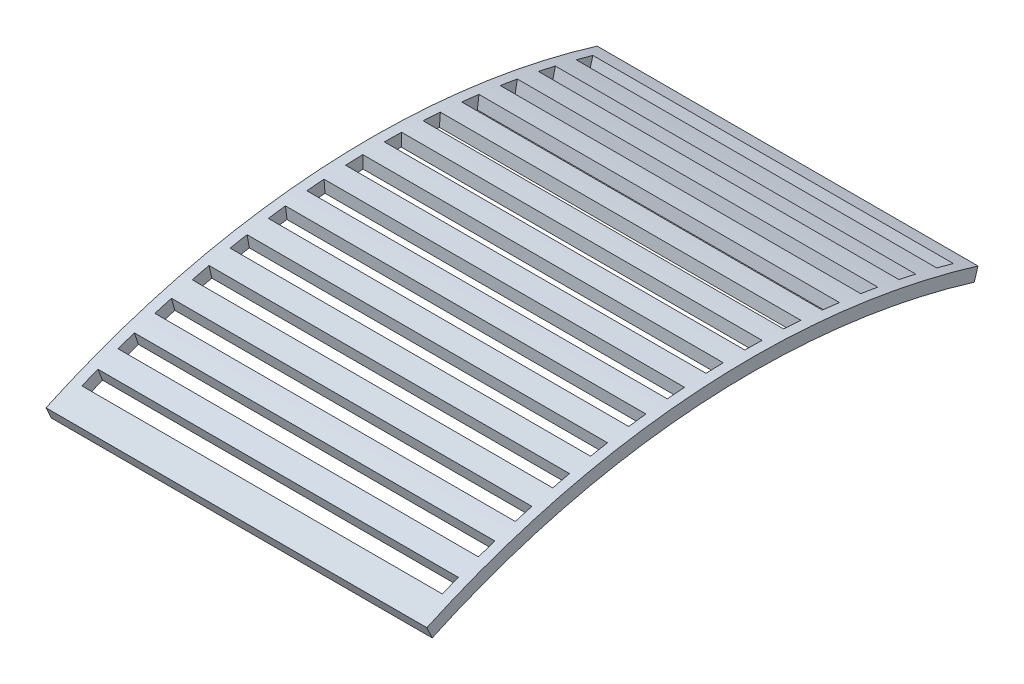
from build123d import *

# Parameters (mm, degrees)
SKETCH2_R                 = 180
SKETCH2_R_2               = 178
EXTRUDE_THIN1_DEPTH       = 90
WRAP1_SECTION_W           = 3
WRAP1_SECTION_H           = 2.3866999
WRAP1_ANGLE               = 41.69859509
WRAP1_SECTOR_2_SECTION_W  = 3
WRAP1_SECTOR_2_SECTION_H  = 85
WRAP1_SECTOR_2_ANGLE      = 2.067873213
WRAP1_SECTOR_3_SECTION_W  = 3
WRAP1_SECTOR_3_SECTION_H  = 85
WRAP1_SECTOR_3_ANGLE      = 1.591549431
WRAP1_SECTOR_4_SECTION_W  = 3
WRAP1_SECTOR_4_SECTION_H  = 85
WRAP1_SECTOR_4_ANGLE      = 1.591549431
WRAP1_SECTOR_5_SECTION_W  = 3
WRAP1_SECTOR_5_SECTION_H  = 85
WRAP1_SECTOR_5_ANGLE      = 1.591549431
WRAP1_SECTOR_6_SECTION_W  = 3
WRAP1_SECTOR_6_SECTION_H  = 85
WRAP1_SECTOR_6_ANGLE      = 1.591549431
WRAP1_SECTOR_7_SECTION_W  = 3
WRAP1_SECTOR_7_SECTION_H  = 85
WRAP1_SECTOR_7_ANGLE      = 1.591549431
WRAP1_SECTOR_8_SECTION_W  = 3
WRAP1_SECTOR_8_SECTION_H  = 85
WRAP1_SECTOR_8_ANGLE      = 1.591549431
WRAP1_SECTOR_9_SECTION_W  = 3
WRAP1_SECTOR_9_SECTION_H  = 85
WRAP1_SECTOR_9_ANGLE      = 1.591549431
WRAP1_SECTOR_10_SECTION_W = 3
WRAP1_SECTOR_10_SECTION_H = 85
WRAP1_SECTOR_10_ANGLE     = 1.591549431
WRAP1_SECTOR_11_SECTION_W = 3
WRAP1_SECTOR_11_SECTION_H = 85
WRAP1_SECTOR_11_ANGLE     = 1.591549431
WRAP1_SECTOR_12_SECTION_W = 3
WRAP1_SECTOR_12_SECTION_H = 85
WRAP1_SECTOR_12_ANGLE     = 1.591549431
WRAP1_SECTOR_13_SECTION_W = 3
WRAP1_SECTOR_13_SECTION_H = 85
WRAP1_SECTOR_13_ANGLE     = 1.591549431
WRAP1_SECTOR_14_SECTION_W = 3
WRAP1_SECTOR_14_SECTION_H = 85
WRAP1_SECTOR_14_ANGLE     = 1.591549431
WRAP1_SECTOR_15_SECTION_W = 3
WRAP1_SECTOR_15_SECTION_H = 85
WRAP1_SECTOR_15_ANGLE     = 1.591549431
WRAP1_SECTOR_16_SECTION_W = 3
WRAP1_SECTOR_16_SECTION_H = 85
WRAP1_SECTOR_16_ANGLE     = 1.115225649
WRAP1_SECTOR_17_SECTION_W = 3
WRAP1_SECTOR_17_SECTION_H = 2.4233001
WRAP1_SECTOR_17_ANGLE     = 41.69859509
SKETCH5_R                 = 180
CUT_EXTRUDE1_DEPTH        = 119


with BuildPart() as part:
    # Sketch2 → Extrude-Thin1 (new body)
    with BuildSketch(Plane(origin=(0, 0, 0), x_dir=(0, 0, -1), z_dir=(1, 0, 0))):
        with Locations((0, -8.237834894)):
            Circle(SKETCH2_R)
        with Locations((0, -8.237834894)):
            Circle(SKETCH2_R_2, mode=Mode.SUBTRACT)
    extrude(amount=EXTRUDE_THIN1_DEPTH)

    # Wrap1 section (on wrap section) → Wrap1 (revolve)
    with BuildSketch(Plane(origin=(0, -8.237834894, 0), x_dir=(0, 0.9080540786996547, 0.41885294574220344), z_dir=(0, -0.41885294574220344, 0.9080540786996547))):
        with Locations((181.5, -88.70726195)):
            Rectangle(WRAP1_SECTION_W, WRAP1_SECTION_H)
    revolve(axis=Axis((0, -8.237834894, 0), (-1, 0, 0)), revolution_arc=WRAP1_ANGLE)

    # Wrap1 sector 2 section (on wrap section) → Wrap1 sector 2 (revolve)
    with BuildSketch(Plane(origin=(0, -8.237834894, 0), x_dir=(0, 0.9080540786996547, 0.41885294574220344), z_dir=(0, -0.41885294574220344, 0.9080540786996547))):
        with Locations((181.5, -45.013912)):
            Rectangle(WRAP1_SECTOR_2_SECTION_W, WRAP1_SECTOR_2_SECTION_H)
    revolve(axis=Axis((0, -8.237834894, 0), (-1, 0, 0)), revolution_arc=WRAP1_SECTOR_2_ANGLE)

    # Wrap1 sector 3 section (on wrap section) → Wrap1 sector 3 (revolve)
    with BuildSketch(Plane(origin=(0, -8.237834894, 0), x_dir=(0, 0.9309215245835882, 0.3652192698461676), z_dir=(0, -0.3652192698461676, 0.9309215245835882))):
        with Locations((181.5, -45.013912)):
            Rectangle(WRAP1_SECTOR_3_SECTION_W, WRAP1_SECTOR_3_SECTION_H)
    revolve(axis=Axis((0, -8.237834894, 0), (-1, 0, 0)), revolution_arc=WRAP1_SECTOR_3_ANGLE)

    # Wrap1 sector 4 section (on wrap section) → Wrap1 sector 4 (revolve)
    with BuildSketch(Plane(origin=(0, -8.237834894, 0), x_dir=(0, 0.9480114707936929, 0.3182361564052382), z_dir=(0, -0.3182361564052382, 0.9480114707936929))):
        with Locations((181.5, -45.013912)):
            Rectangle(WRAP1_SECTOR_4_SECTION_W, WRAP1_SECTOR_4_SECTION_H)
    revolve(axis=Axis((0, -8.237834894, 0), (-1, 0, 0)), revolution_arc=WRAP1_SECTOR_4_ANGLE)

    # Wrap1 sector 5 section (on wrap section) → Wrap1 sector 5 (revolve)
    with BuildSketch(Plane(origin=(0, -8.237834894, 0), x_dir=(0, 0.9627318820416432, 0.2704576183074822), z_dir=(0, -0.2704576183074822, 0.9627318820416432))):
        with Locations((181.5, -45.013912)):
            Rectangle(WRAP1_SECTOR_5_SECTION_W, WRAP1_SECTOR_5_SECTION_H)
    revolve(axis=Axis((0, -8.237834894, 0), (-1, 0, 0)), revolution_arc=WRAP1_SECTOR_5_ANGLE)

    # Wrap1 sector 6 section (on wrap section) → Wrap1 sector 6 (revolve)
    with BuildSketch(Plane(origin=(0, -8.237834894, 0), x_dir=(0, 0.9750459649655612, 0.22200307701556227), z_dir=(0, -0.22200307701556227, 0.9750459649655612))):
        with Locations((181.5, -45.013912)):
            Rectangle(WRAP1_SECTOR_6_SECTION_W, WRAP1_SECTOR_6_SECTION_H)
    revolve(axis=Axis((0, -8.237834894, 0), (-1, 0, 0)), revolution_arc=WRAP1_SECTOR_6_ANGLE)

    # Wrap1 sector 7 section (on wrap section) → Wrap1 sector 7 (revolve)
    with BuildSketch(Plane(origin=(0, -8.237834894, 0), x_dir=(0, 0.9849229407711876, 0.17299364364807088), z_dir=(0, -0.17299364364807088, 0.9849229407711876))):
        with Locations((181.5, -45.013912)):
            Rectangle(WRAP1_SECTOR_7_SECTION_W, WRAP1_SECTOR_7_SECTION_H)
    revolve(axis=Axis((0, -8.237834894, 0), (-1, 0, 0)), revolution_arc=WRAP1_SECTOR_7_ANGLE)

    # Wrap1 sector 8 section (on wrap section) → Wrap1 sector 8 (revolve)
    with BuildSketch(Plane(origin=(0, -8.237834894, 0), x_dir=(0, 0.9923381221628379, 0.1235518162648073), z_dir=(0, -0.1235518162648073, 0.9923381221628379))):
        with Locations((181.5, -45.013912)):
            Rectangle(WRAP1_SECTOR_8_SECTION_W, WRAP1_SECTOR_8_SECTION_H)
    revolve(axis=Axis((0, -8.237834894, 0), (-1, 0, 0)), revolution_arc=WRAP1_SECTOR_8_ANGLE)

    # Wrap1 sector 9 section (on wrap section) → Wrap1 sector 9 (revolve)
    with BuildSketch(Plane(origin=(0, -8.237834894, 0), x_dir=(0, 0.9972729750487846, 0.07380117368542383), z_dir=(0, -0.07380117368542383, 0.9972729750487846))):
        with Locations((181.5, -45.013912)):
            Rectangle(WRAP1_SECTOR_9_SECTION_W, WRAP1_SECTOR_9_SECTION_H)
    revolve(axis=Axis((0, -8.237834894, 0), (-1, 0, 0)), revolution_arc=WRAP1_SECTOR_9_ANGLE)

    # Wrap1 sector 10 section (on wrap section) → Wrap1 sector 10 (revolve)
    with BuildSketch(Plane(origin=(0, -8.237834894, 0), x_dir=(0, 0.9997151648668349, 0.02386606660673497), z_dir=(0, -0.02386606660673497, 0.9997151648668349))):
        with Locations((181.5, -45.013912)):
            Rectangle(WRAP1_SECTOR_10_SECTION_W, WRAP1_SECTOR_10_SECTION_H)
    revolve(axis=Axis((0, -8.237834894, 0), (-1, 0, 0)), revolution_arc=WRAP1_SECTOR_10_ANGLE)

    # Wrap1 sector 11 section (on wrap section) → Wrap1 sector 11 (revolve)
    with BuildSketch(Plane(origin=(0, -8.237834894, 0), x_dir=(0, 0.9996585874143112, -0.02612869320926344), z_dir=(0, 0.02612869320926344, 0.9996585874143112))):
        with Locations((181.5, -45.013912)):
            Rectangle(WRAP1_SECTOR_11_SECTION_W, WRAP1_SECTOR_11_SECTION_H)
    revolve(axis=Axis((0, -8.237834894, 0), (-1, 0, 0)), revolution_arc=WRAP1_SECTOR_11_ANGLE)

    # Wrap1 sector 12 section (on wrap section) → Wrap1 sector 12 (revolve)
    with BuildSketch(Plane(origin=(0, -8.237834894, 0), x_dir=(0, 0.9971033841053801, -0.07605814489979906), z_dir=(0, 0.07605814489979906, 0.9971033841053801))):
        with Locations((181.5, -45.013912)):
            Rectangle(WRAP1_SECTOR_12_SECTION_W, WRAP1_SECTOR_12_SECTION_H)
    revolve(axis=Axis((0, -8.237834894, 0), (-1, 0, 0)), revolution_arc=WRAP1_SECTOR_12_ANGLE)

    # Wrap1 sector 13 section (on wrap section) → Wrap1 sector 13 (revolve)
    with BuildSketch(Plane(origin=(0, -8.237834894, 0), x_dir=(0, 0.9920559416175896, -0.12579749083840142), z_dir=(0, 0.12579749083840142, 0.9920559416175896))):
        with Locations((181.5, -45.013912)):
            Rectangle(WRAP1_SECTOR_13_SECTION_W, WRAP1_SECTOR_13_SECTION_H)
    revolve(axis=Axis((0, -8.237834894, 0), (-1, 0, 0)), revolution_arc=WRAP1_SECTOR_13_ANGLE)

    # Wrap1 sector 14 section (on wrap section) → Wrap1 sector 14 (revolve)
    with BuildSketch(Plane(origin=(0, -8.237834894, 0), x_dir=(0, 0.984528875928502, -0.17522240856397442), z_dir=(0, 0.17522240856397442, 0.984528875928502))):
        with Locations((181.5, -45.013912)):
            Rectangle(WRAP1_SECTOR_14_SECTION_W, WRAP1_SECTOR_14_SECTION_H)
    revolve(axis=Axis((0, -8.237834894, 0), (-1, 0, 0)), revolution_arc=WRAP1_SECTOR_14_ANGLE)

    # Wrap1 sector 15 section (on wrap section) → Wrap1 sector 15 (revolve)
    with BuildSketch(Plane(origin=(0, -8.237834894, 0), x_dir=(0, 0.97454100078232, -0.22420936152220386), z_dir=(0, 0.22420936152220386, 0.97454100078232))):
        with Locations((181.5, -45.013912)):
            Rectangle(WRAP1_SECTOR_15_SECTION_W, WRAP1_SECTOR_15_SECTION_H)
    revolve(axis=Axis((0, -8.237834894, 0), (-1, 0, 0)), revolution_arc=WRAP1_SECTOR_15_ANGLE)

    # Wrap1 sector 16 section (on wrap section) → Wrap1 sector 16 (revolve)
    with BuildSketch(Plane(origin=(0, -8.237834894, 0), x_dir=(0, 0.9621172806653241, -0.27263590784260605), z_dir=(0, 0.27263590784260605, 0.9621172806653241))):
        with Locations((181.5, -45.013912)):
            Rectangle(WRAP1_SECTOR_16_SECTION_W, WRAP1_SECTOR_16_SECTION_H)
    revolve(axis=Axis((0, -8.237834894, 0), (-1, 0, 0)), revolution_arc=WRAP1_SECTOR_16_ANGLE)

    # Wrap1 sector 17 section (on wrap section) → Wrap1 sector 17 (revolve)
    with BuildSketch(Plane(origin=(0, -8.237834894, 0), x_dir=(0, 0.9080540786996547, 0.41885294574220344), z_dir=(0, -0.41885294574220344, 0.9080540786996547))):
        with Locations((181.5, -1.30226195)):
            Rectangle(WRAP1_SECTOR_17_SECTION_W, WRAP1_SECTOR_17_SECTION_H)
    revolve(axis=Axis((0, -8.237834894, 0), (-1, 0, 0)), revolution_arc=WRAP1_SECTOR_17_ANGLE)

    # Sketch5 → Cut-Extrude1 (cut)
    with BuildSketch(Plane(origin=(0, 0, 0), x_dir=(0, 0, -1), z_dir=(1, 0, 0))):
        with Locations((0, -8.237834894)):
            Circle(SKETCH5_R)
    extrude(amount=CUT_EXTRUDE1_DEPTH, mode=Mode.SUBTRACT)


solid = part.part
